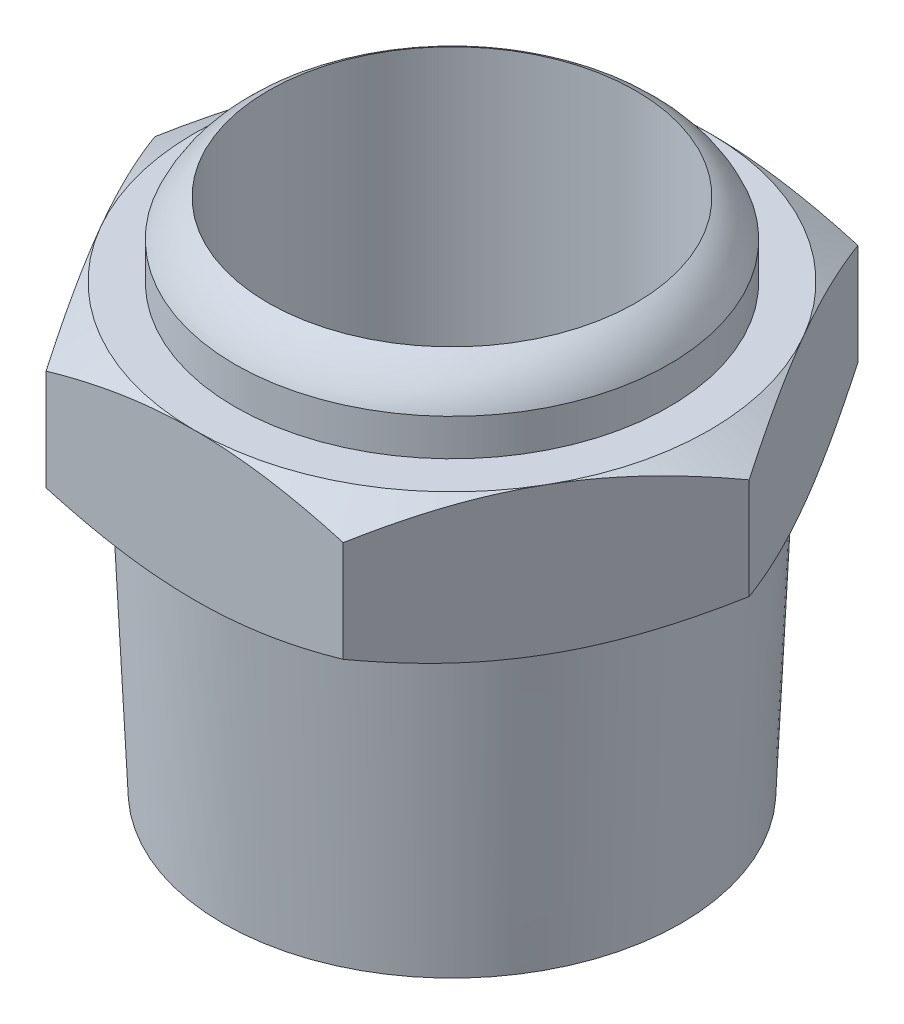
from build123d import *

# Parameters (mm, degrees)
HEXBASE_DEPTH             = 2
TUBECLAMPINGHEADS_R       = 5.9
TUBECLAMPINGHEAD_DEPTH    = 2
FASTENINGHEADS_R          = 6.5785
FASTENINGHEAD_DEPTH       = 8
FASTENINGHEAD_TAPER       = 2.5
BOREFASTENINGHEADS_R      = 4.7
BOREFASTENINGHEAD_DEPTH   = 3.2
HEXKEY_DEPTH              = 16.197806859
BORETUBEACCESSS_R         = 5
BORETUBEACCESS_DEPTH      = 9.8
ORINGSEAT_START           = 1.5
ORINGSEATS_R              = 5
ORINGSEATS_R_2            = 4
ORINGSEAT_DEPTH           = 1.5
CHAMFERHEXBASES_OUTSIDE_W = 82.42
CHAMFERHEXBASES_OUTSIDE_H = 80.254
CHAMFERHEXBASES_OUTSIDE_R = 7
CHAMFERHEXBASE_DEPTH      = 17.072751343
CHAMFERHEXBASE_DRAFT      = -60
CHB_VM_COPY_1_SKETCH_W    = 82.42
CHB_VM_COPY_1_SKETCH_H    = 80.254
CHB_VM_COPY_1_SKETCH_R    = 7
CHB_VM_COPY_1_DEPTH       = 17.072751343
CHB_VM_COPY_1_DRAFT       = -60


with BuildPart() as part:
    # HexBaseS → HexBase (new, symmetric)
    with BuildSketch(Plane(origin=(0, 0, 0), x_dir=(1, 0, 0), z_dir=(0, 1, 0))):
        Polygon((8.082903769, 0), (4.041451884, 7), (-4.041451884, 7), (-8.082903769, 0), (-4.041451884, -7), (4.041451884, -7), align=None)
    extrude(amount=HEXBASE_DEPTH, both=True)

    # TubeClampingHeadS → TubeClampingHead (add)
    with BuildSketch(Plane(origin=(0, 2, 0), x_dir=(1, 0, 0), z_dir=(0, 1, 0))):
        with Locations(Location((0, 0, 0), (0, 0, 270))):
            Circle(TUBECLAMPINGHEADS_R)
    extrude(amount=TUBECLAMPINGHEAD_DEPTH)

    # FasteningHeadS → FasteningHead (add)
    with BuildSketch(Plane(origin=(0, -2, 0), x_dir=(-1, 0, 0), z_dir=(0, -1, 0))):
        Circle(FASTENINGHEADS_R)
    extrude(amount=FASTENINGHEAD_DEPTH, taper=FASTENINGHEAD_TAPER)

    # BoreFasteningHeadS → BoreFasteningHead (cut)
    with BuildSketch(Plane.XZ.offset(10)):
        with Locations(Location((0, 0, 0), (0, 0, 270))):
            Circle(BOREFASTENINGHEADS_R)
    extrude(amount=-BOREFASTENINGHEAD_DEPTH, mode=Mode.SUBTRACT)

    # HexKeyS → HexKey (cut, through all)
    with BuildSketch(Plane(origin=(0, -6.8, 0), x_dir=(-1, 0, 0), z_dir=(0, -1, 0))):
        Polygon((-1.443375673, 2.5), (-2.886751346, 0), (-1.443375673, -2.5), (1.443375673, -2.5), (2.886751346, 0), (1.443375673, 2.5), align=None)
    extrude(amount=-HEXKEY_DEPTH, mode=Mode.SUBTRACT)

    # BoreTubeAccessS → BoreTubeAccess (cut)
    with BuildSketch(Plane(origin=(0, 4, 0), x_dir=(1, 0, 0), z_dir=(0, 1, 0))):
        with Locations(Location((0, 0, 0), (0, 0, 270))):
            Circle(BORETUBEACCESSS_R)
    extrude(amount=-BORETUBEACCESS_DEPTH, mode=Mode.SUBTRACT)

    # ClampingFeatureS → ClampingFeature (revolve, cut)
    with BuildSketch(Plane.XY, mode=Mode.PRIVATE) as clampingfeature_sk:
        with BuildLine():
            Line((5, 4), (5.9, 4))
            Line((5.9, 4), (5.9, 3))
            ThreePointArc((5.9, 3), (5.536608024, 3.577947222), (5, 4))
        make_face()
    revolve(clampingfeature_sk.sketch.rotate(Axis((0, 4, 0), (0, -1, 0)), 90), axis=Axis((0, 4, 0), (0, -1, 0)), mode=Mode.SUBTRACT)

    # ORingSeatS → ORingSeat (add)
    with BuildSketch(Plane(origin=(0, -5.8, 0), x_dir=(1, 0, 0), z_dir=(0, 1, 0)).offset(ORINGSEAT_START)):
        with Locations(Location((0, 0, 0), (0, 0, 270))):
            Circle(ORINGSEATS_R)
        with Locations(Location((0, 0, 0), (0, 0, 270))):
            Circle(ORINGSEATS_R_2, mode=Mode.SUBTRACT)
    extrude(amount=-ORINGSEAT_DEPTH)


with BuildPart() as chamferhexbase_tool:
    # ChamferHexBaseS outside → ChamferHexBase (with draft: the straight prism first)
    with BuildSketch(Plane(origin=(0, 2, 0), x_dir=(1, 0, 0), z_dir=(0, 1, 0))):
        Rectangle(CHAMFERHEXBASES_OUTSIDE_W, CHAMFERHEXBASES_OUTSIDE_H)
        Circle(CHAMFERHEXBASES_OUTSIDE_R, mode=Mode.SUBTRACT)
    extrude(amount=-CHAMFERHEXBASE_DEPTH)
    # ChamferHexBase: the draft: its side faces are tilted about the plane it starts from
    chamferhexbase_sides = [chamferhexbase_tool.faces().sort_by_distance(p)[0] for p in [
        (0, -6.536375671, 40.127),
        (41.21, -6.536375671, 0),
        (0, -6.536375671, -40.127),
        (-41.21, -6.536375671, 0),
        (-7, -6.536375671, 0),
    ]]
    draft(chamferhexbase_sides, Plane(origin=(0, 2, 0), x_dir=(1, 0, 0), z_dir=(0, 1, 0)), CHAMFERHEXBASE_DRAFT)


with BuildPart() as part_1:
    add(part.part)

    # ChamferHexBase: cut by chamferhexbase_tool
    add(chamferhexbase_tool.part, mode=Mode.SUBTRACT)


with BuildPart() as chb_vm_copy_1_tool:
    # CHB VM copy 1 sketch → CHB VM copy 1 (with draft: the straight prism first)
    with BuildSketch(Plane.XZ.offset(2)):
        Rectangle(CHB_VM_COPY_1_SKETCH_W, CHB_VM_COPY_1_SKETCH_H)
        Circle(CHB_VM_COPY_1_SKETCH_R, mode=Mode.SUBTRACT)
    extrude(amount=-CHB_VM_COPY_1_DEPTH)
    # CHB VM copy 1: the draft: its side faces are tilted about the plane it starts from
    chb_vm_copy_1_sides = [chb_vm_copy_1_tool.faces().sort_by_distance(p)[0] for p in [
        (0, 6.536375671, 40.127),
        (41.21, 6.536375671, 0),
        (0, 6.536375671, -40.127),
        (-41.21, 6.536375671, 0),
        (-7, 6.536375671, 0),
    ]]
    draft(chb_vm_copy_1_sides, Plane.XZ.offset(2), CHB_VM_COPY_1_DRAFT)


with BuildPart() as part_2:
    add(part_1.part)

    # CHB VM copy 1: cut by chb_vm_copy_1_tool
    add(chb_vm_copy_1_tool.part, mode=Mode.SUBTRACT)


solid = part_2.part
